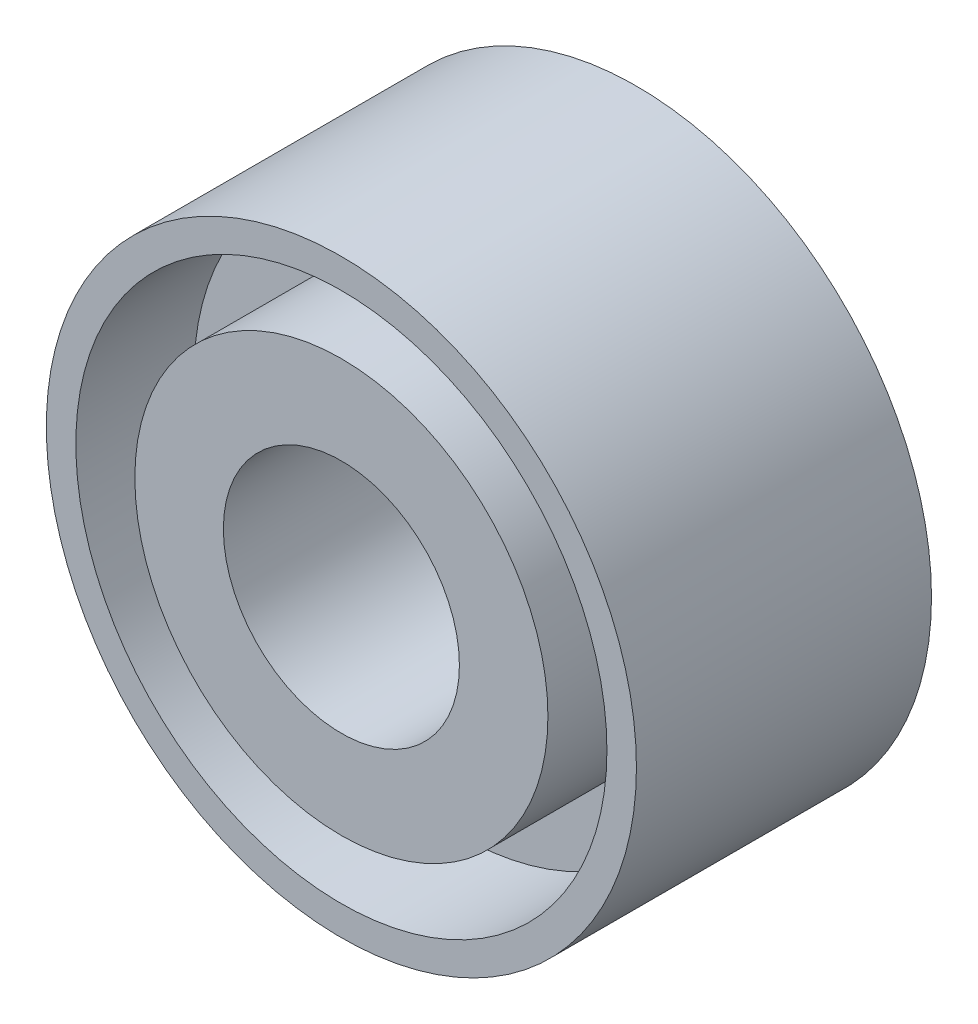
from build123d import *

# Parameters (mm, degrees)
SKETCH1_R           = 5
SKETCH1_R_2         = 2
BOSS_EXTRUDE1_DEPTH = 5
SKETCH2_R           = 4.5
SKETCH2_R_2         = 3.5
CUT_EXTRUDE1_DEPTH  = 2


with BuildPart() as part:
    # Sketch1 → Boss-Extrude1 (new body)
    with BuildSketch(Plane.XY):
        Circle(SKETCH1_R)
        Circle(SKETCH1_R_2, mode=Mode.SUBTRACT)
    extrude(amount=BOSS_EXTRUDE1_DEPTH)

    # Sketch2 → Cut-Extrude1 (cut)
    with BuildSketch(Plane.XY.offset(5)):
        Circle(SKETCH2_R)
        Circle(SKETCH2_R_2, mode=Mode.SUBTRACT)
    extrude(amount=-CUT_EXTRUDE1_DEPTH, mode=Mode.SUBTRACT)


solid = part.part
